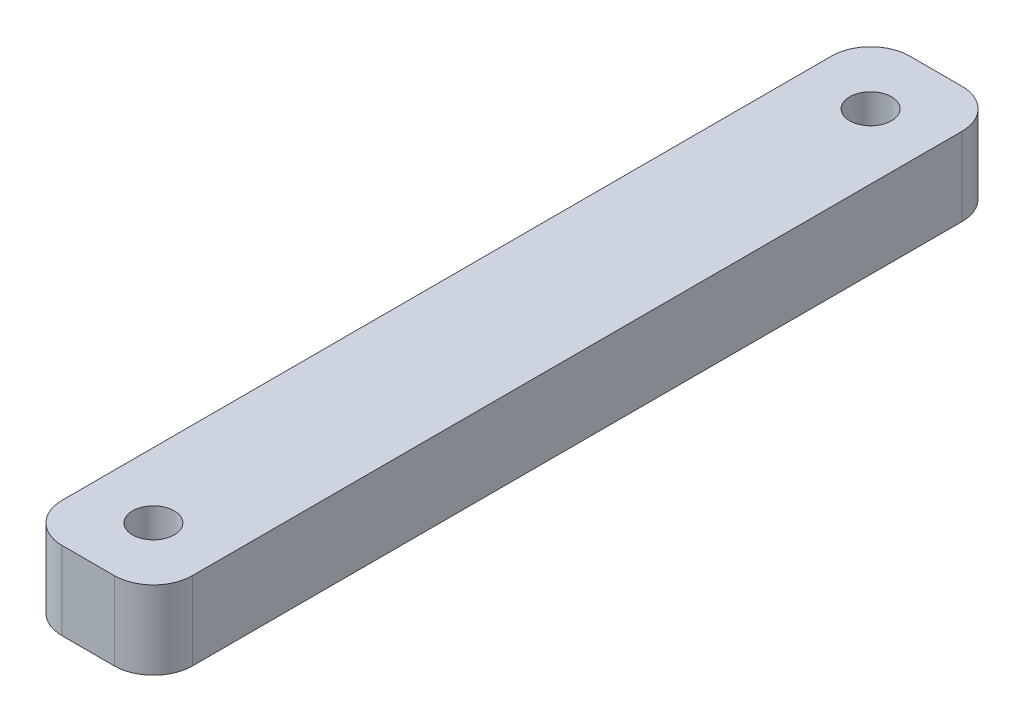
from build123d import *

# Parameters (mm, degrees)
SKETCH1_W           = 10
SKETCH1_H           = 6
BOSS_EXTRUDE1_DEPTH = 65
SKETCH2_R           = 1.6
CUT_EXTRUDE1_DEPTH  = 67.037867924
FILLET1_R           = 3


with BuildPart() as part:
    # Sketch1 → Boss-Extrude1 (new body)
    with BuildSketch(Plane.XY):
        with Locations((5, -3)):
            Rectangle(SKETCH1_W, SKETCH1_H)
    extrude(amount=BOSS_EXTRUDE1_DEPTH)

    # Sketch2 → Cut-Extrude1 (cut, through all)
    with BuildSketch(Plane(origin=(0, 0, 0), x_dir=(1, 0, 0), z_dir=(0, 1, 0))):
        with Locations(Location((5, -5, 0), (0, 0, 270))):
            Circle(SKETCH2_R)
        with Locations(Location((5, -60, 0), (0, 0, 270))):
            Circle(SKETCH2_R)
    extrude(amount=-CUT_EXTRUDE1_DEPTH, mode=Mode.SUBTRACT)

    # Fillet1
    fillet1_edges = [part.edges().sort_by_distance(p)[0] for p in [
        (10, -3, 65),
        (0, -3, 65),
        (10, -3, 0),
        (0, -3, 0),
    ]]
    fillet(fillet1_edges, radius=FILLET1_R)


solid = part.part
